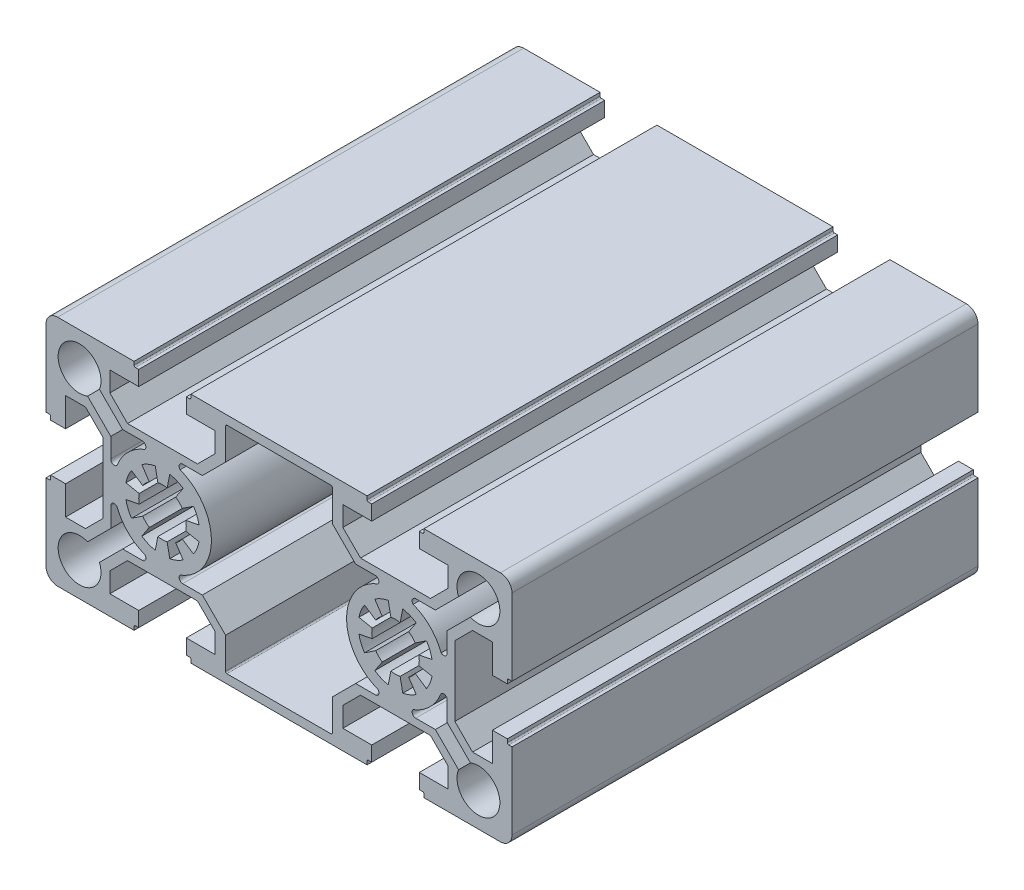
from build123d import *

# Parameters (mm, degrees)
EXTRUDE_1_DEPTH = 100


with BuildPart() as part:
    # 草图1 → 凸台-拉伸1 (new body)
    with BuildSketch(Plane.XY):
        with BuildLine():
            Line((-31.582808051, 26.059817672), (-47.982808051, 26.059817672))
            ThreePointArc((-47.982808051, 26.059817672), (-49.750575003, 25.327584625), (-50.482808051, 23.559817672))
            Line((-50.482808051, 23.559817672), (-50.482808051, 7.159817672))
            Line((-50.482808051, 7.159817672), (-49.782808051, 7.159817672))
            ThreePointArc((-49.782808051, 7.159817672), (-49.570676016, 7.071949706), (-49.482808051, 6.859817672))
            Line((-49.482808051, 6.859817672), (-49.482808051, 6.159817672))
            Line((-49.482808051, 6.159817672), (-46.282808051, 6.159817672))
            Line((-46.282808051, 6.159817672), (-46.282808051, 12.359817672))
            Line((-46.282808051, 12.359817672), (-42.015398231, 12.359817672))
            Line((-42.015398231, 12.359817672), (-38.215398231, 8.559817672))
            Line((-38.215398231, 8.559817672), (-38.215398231, 1.059817672))
            Line((-38.215398231, 1.059817672), (-38.215398231, -6.440182328))
            Line((-38.215398231, -6.440182328), (-42.015398231, -10.240182328))
            Line((-42.015398231, -10.240182328), (-46.282808051, -10.240182328))
            Line((-46.282808051, -10.240182328), (-46.282808051, -4.040182328))
            Line((-46.282808051, -4.040182328), (-49.482808051, -4.040182328))
            Line((-49.482808051, -4.040182328), (-49.482808051, -4.740182328))
            ThreePointArc((-49.482808051, -4.740182328), (-49.570676016, -4.952314363), (-49.782808051, -5.040182328))
            Line((-49.782808051, -5.040182328), (-50.482808051, -5.040182328))
            Line((-50.482808051, -5.040182328), (-50.482808051, -21.440182328))
            ThreePointArc((-50.482808051, -21.440182328), (-49.750575003, -23.207949281), (-47.982808051, -23.940182328))
            Line((-47.982808051, -23.940182328), (-31.582808051, -23.940182328))
            Line((-31.582808051, -23.940182328), (-31.582808051, -23.240182328))
            ThreePointArc((-31.582808051, -23.240182328), (-31.494940085, -23.028050294), (-31.282808051, -22.940182328))
            Line((-31.282808051, -22.940182328), (-30.582808051, -22.940182328))
            Line((-30.582808051, -22.940182328), (-30.582808051, -19.740182328))
            Line((-30.582808051, -19.740182328), (-36.782808051, -19.740182328))
            Line((-36.782808051, -19.740182328), (-36.782808051, -15.472772509))
            Line((-36.782808051, -15.472772509), (-32.982808051, -11.672772509))
            Line((-32.982808051, -11.672772509), (-25.482808051, -11.672772509))
            Line((-25.482808051, -11.672772509), (-17.982808051, -11.672772509))
            Line((-17.982808051, -11.672772509), (-14.182808051, -15.472772509))
            Line((-14.182808051, -15.472772509), (-14.182808051, -19.740182328))
            Line((-14.182808051, -19.740182328), (-20.382808051, -19.740182328))
            Line((-20.382808051, -19.740182328), (-20.382808051, -22.940182328))
            Line((-20.382808051, -22.940182328), (-19.682808051, -22.940182328))
            ThreePointArc((-19.682808051, -22.940182328), (-19.470676016, -23.028050294), (-19.382808051, -23.240182328))
            Line((-19.382808051, -23.240182328), (-19.382808051, -23.940182328))
            Line((-19.382808051, -23.940182328), (-2.982808051, -23.940182328))
            Line((-2.982808051, -23.940182328), (2.017191949, -23.940182328))
            Line((2.017191949, -23.940182328), (18.417191949, -23.940182328))
            Line((18.417191949, -23.940182328), (18.417191949, -23.240182328))
            ThreePointArc((18.417191949, -23.240182328), (18.505059915, -23.028050294), (18.717191949, -22.940182328))
            Line((18.717191949, -22.940182328), (19.417191949, -22.940182328))
            Line((19.417191949, -22.940182328), (19.417191949, -19.740182328))
            Line((19.417191949, -19.740182328), (13.217191949, -19.740182328))
            Line((13.217191949, -19.740182328), (13.217191949, -15.472772509))
            Line((13.217191949, -15.472772509), (17.017191949, -11.672772509))
            Line((17.017191949, -11.672772509), (24.517191949, -11.672772509))
            Line((24.517191949, -11.672772509), (32.017191949, -11.672772509))
            Line((32.017191949, -11.672772509), (35.817191949, -15.472772509))
            Line((35.817191949, -15.472772509), (35.817191949, -19.740182328))
            Line((35.817191949, -19.740182328), (29.617191949, -19.740182328))
            Line((29.617191949, -19.740182328), (29.617191949, -22.940182328))
            Line((29.617191949, -22.940182328), (30.317191949, -22.940182328))
            ThreePointArc((30.317191949, -22.940182328), (30.529323984, -23.028050294), (30.617191949, -23.240182328))
            Line((30.617191949, -23.240182328), (30.617191949, -23.940182328))
            Line((30.617191949, -23.940182328), (47.017191949, -23.940182328))
            ThreePointArc((47.017191949, -23.940182328), (48.784958902, -23.207949281), (49.517191949, -21.440182328))
            Line((49.517191949, -21.440182328), (49.517191949, -5.040182328))
            Line((49.517191949, -5.040182328), (48.817191949, -5.040182328))
            ThreePointArc((48.817191949, -5.040182328), (48.605059915, -4.952314363), (48.517191949, -4.740182328))
            Line((48.517191949, -4.740182328), (48.517191949, -4.040182328))
            Line((48.517191949, -4.040182328), (45.317191949, -4.040182328))
            Line((45.317191949, -4.040182328), (45.317191949, -10.240182328))
            Line((45.317191949, -10.240182328), (41.04978213, -10.240182328))
            Line((41.04978213, -10.240182328), (37.24978213, -6.440182328))
            Line((37.24978213, -6.440182328), (37.24978213, 1.059817672))
            Line((37.24978213, 1.059817672), (37.24978213, 8.559817672))
            Line((37.24978213, 8.559817672), (41.04978213, 12.359817672))
            Line((41.04978213, 12.359817672), (45.317191949, 12.359817672))
            Line((45.317191949, 12.359817672), (45.317191949, 6.159817672))
            Line((45.317191949, 6.159817672), (48.517191949, 6.159817672))
            Line((48.517191949, 6.159817672), (48.517191949, 6.859817672))
            ThreePointArc((48.517191949, 6.859817672), (48.605059915, 7.071949706), (48.817191949, 7.159817672))
            Line((48.817191949, 7.159817672), (49.517191949, 7.159817672))
            Line((49.517191949, 7.159817672), (49.517191949, 23.559817672))
            ThreePointArc((49.517191949, 23.559817672), (48.784958902, 25.327584625), (47.017191949, 26.059817672))
            Line((47.017191949, 26.059817672), (30.617191949, 26.059817672))
            Line((30.617191949, 26.059817672), (30.617191949, 25.359817672))
            ThreePointArc((30.617191949, 25.359817672), (30.529323984, 25.147685637), (30.317191949, 25.059817672))
            Line((30.317191949, 25.059817672), (29.617191949, 25.059817672))
            Line((29.617191949, 25.059817672), (29.617191949, 21.859817672))
            Line((29.617191949, 21.859817672), (35.817191949, 21.859817672))
            Line((35.817191949, 21.859817672), (35.817191949, 17.592407853))
            Line((35.817191949, 17.592407853), (32.017191949, 13.792407853))
            Line((32.017191949, 13.792407853), (24.517191949, 13.792407853))
            Line((24.517191949, 13.792407853), (17.017191949, 13.792407853))
            Line((17.017191949, 13.792407853), (13.217191949, 17.592407853))
            Line((13.217191949, 17.592407853), (13.217191949, 21.859817672))
            Line((13.217191949, 21.859817672), (19.417191949, 21.859817672))
            Line((19.417191949, 21.859817672), (19.417191949, 25.059817672))
            Line((19.417191949, 25.059817672), (18.717191949, 25.059817672))
            ThreePointArc((18.717191949, 25.059817672), (18.505059915, 25.147685637), (18.417191949, 25.359817672))
            Line((18.417191949, 25.359817672), (18.417191949, 26.059817672))
            Line((18.417191949, 26.059817672), (2.017191949, 26.059817672))
            Line((2.017191949, 26.059817672), (-2.982808051, 26.059817672))
            Line((-2.982808051, 26.059817672), (-19.382808051, 26.059817672))
            Line((-19.382808051, 26.059817672), (-19.382808051, 25.359817672))
            ThreePointArc((-19.382808051, 25.359817672), (-19.470676016, 25.147685637), (-19.682808051, 25.059817672))
            Line((-19.682808051, 25.059817672), (-20.382808051, 25.059817672))
            Line((-20.382808051, 25.059817672), (-20.382808051, 21.859817672))
            Line((-20.382808051, 21.859817672), (-14.182808051, 21.859817672))
            Line((-14.182808051, 21.859817672), (-14.182808051, 17.592407853))
            Line((-14.182808051, 17.592407853), (-17.982808051, 13.792407853))
            Line((-17.982808051, 13.792407853), (-25.482808051, 13.792407853))
            Line((-25.482808051, 13.792407853), (-32.982808051, 13.792407853))
            Line((-32.982808051, 13.792407853), (-36.782808051, 17.592407853))
            Line((-36.782808051, 17.592407853), (-36.782808051, 21.859817672))
            Line((-36.782808051, 21.859817672), (-30.582808051, 21.859817672))
            Line((-30.582808051, 21.859817672), (-30.582808051, 25.059817672))
            Line((-30.582808051, 25.059817672), (-31.282808051, 25.059817672))
            ThreePointArc((-31.282808051, 25.059817672), (-31.494940085, 25.147685637), (-31.582808051, 25.359817672))
            Line((-31.582808051, 25.359817672), (-31.582808051, 26.059817672))
        make_face()
        with BuildLine():
            Line((-36.582808051, 5.391903688), (-36.582808051, 9.61423326))
            Line((-36.582808051, 9.61423326), (-41.562274347, 14.593699556))
            ThreePointArc((-41.562274347, 14.593699556), (-46.535499244, 22.112508865), (-39.016689935, 17.139283969))
            Line((-39.016689935, 17.139283969), (-34.037223638, 12.159817672))
            Line((-34.037223638, 12.159817672), (-29.814894067, 12.159817672))
            ThreePointArc((-29.814894067, 12.159817672), (-29.106940294, 11.688982743), (-29.267414051, 10.854038285))
            ThreePointArc((-29.267414051, 10.854038285), (-32.907429253, 8.484438874), (-35.277028664, 4.844423672))
            ThreePointArc((-35.277028664, 4.844423672), (-36.111973121, 4.683949916), (-36.582808051, 5.391903688))
        make_face(mode=Mode.SUBTRACT)
        with BuildLine():
            Line((-29.927369915, -5.591939227), (-28.316216239, -3.180677351))
            ThreePointArc((-28.316216239, -3.180677351), (-29.089052635, -2.546426912), (-29.723303073, -1.773590517))
            Line((-29.723303073, -1.773590517), (-32.134564949, -3.384744192))
            ThreePointArc((-32.134564949, -3.384744192), (-32.873844311, -2.001649787), (-33.329090294, -0.500904904))
            Line((-33.329090294, -0.500904904), (-30.484812981, 0.06485703))
            ThreePointArc((-30.484812981, 0.06485703), (-30.582808051, 1.059817672), (-30.484812981, 2.054778314))
            Line((-30.484812981, 2.054778314), (-33.329090294, 2.620540248))
            ThreePointArc((-33.329090294, 2.620540248), (-32.873844311, 4.121285131), (-32.134564949, 5.504379536))
            Line((-32.134564949, 5.504379536), (-29.723303073, 3.89322586))
            ThreePointArc((-29.723303073, 3.89322586), (-29.089052635, 4.666062256), (-28.316216239, 5.300312695))
            Line((-28.316216239, 5.300312695), (-29.927369915, 7.71157457))
            ThreePointArc((-29.927369915, 7.71157457), (-28.544275509, 8.450853932), (-27.043530627, 8.906099915))
            Line((-27.043530627, 8.906099915), (-26.477768693, 6.061822602))
            ThreePointArc((-26.477768693, 6.061822602), (-25.482808051, 6.159817672), (-24.487847408, 6.061822602))
            Line((-24.487847408, 6.061822602), (-23.922085474, 8.906099915))
            ThreePointArc((-23.922085474, 8.906099915), (-22.421340592, 8.450853932), (-21.038246186, 7.71157457))
            Line((-21.038246186, 7.71157457), (-22.649399862, 5.300312695))
            ThreePointArc((-22.649399862, 5.300312695), (-21.876563466, 4.666062256), (-21.242313028, 3.89322586))
            Line((-21.242313028, 3.89322586), (-18.831051152, 5.504379536))
            ThreePointArc((-18.831051152, 5.504379536), (-18.09177179, 4.121285131), (-17.636525807, 2.620540248))
            Line((-17.636525807, 2.620540248), (-20.48080312, 2.054778314))
            ThreePointArc((-20.48080312, 2.054778314), (-20.382808051, 1.059817672), (-20.48080312, 0.06485703))
            Line((-20.48080312, 0.06485703), (-17.636525807, -0.500904904))
            ThreePointArc((-17.636525807, -0.500904904), (-18.09177179, -2.001649787), (-18.831051152, -3.384744192))
            Line((-18.831051152, -3.384744192), (-21.242313028, -1.773590517))
            ThreePointArc((-21.242313028, -1.773590517), (-21.876563466, -2.546426912), (-22.649399862, -3.180677351))
            Line((-22.649399862, -3.180677351), (-21.038246186, -5.591939227))
            ThreePointArc((-21.038246186, -5.591939227), (-22.421340592, -6.331218588), (-23.922085474, -6.786464571))
            Line((-23.922085474, -6.786464571), (-24.487847408, -3.942187258))
            ThreePointArc((-24.487847408, -3.942187258), (-25.482808051, -4.040182328), (-26.477768693, -3.942187258))
            Line((-26.477768693, -3.942187258), (-27.043530627, -6.786464571))
            ThreePointArc((-27.043530627, -6.786464571), (-28.544275509, -6.331218588), (-29.927369915, -5.591939227))
        make_face(mode=Mode.SUBTRACT)
        with BuildLine():
            Line((-11.948926166, 17.139283969), (-11.948926166, 23.859817672))
            ThreePointArc((-11.948926166, 23.859817672), (-11.8610582, 24.071949706), (-11.648926166, 24.159817672))
            Line((-11.648926166, 24.159817672), (-2.982808051, 24.159817672))
            Line((-2.982808051, 24.159817672), (2.017191949, 24.159817672))
            Line((2.017191949, 24.159817672), (10.683310065, 24.159817672))
            ThreePointArc((10.683310065, 24.159817672), (10.895442099, 24.071949706), (10.983310065, 23.859817672))
            Line((10.983310065, 23.859817672), (10.983310065, 17.139283969))
            Line((10.983310065, 17.139283969), (15.962776362, 12.159817672))
            Line((15.962776362, 12.159817672), (20.185105933, 12.159817672))
            ThreePointArc((20.185105933, 12.159817672), (20.893059706, 11.688982743), (20.732585949, 10.854038285))
            ThreePointArc((20.732585949, 10.854038285), (17.092570747, 8.484438874), (14.722971336, 4.844423672))
            ThreePointArc((14.722971336, 4.844423672), (14.91551157, -3.189621573), (20.732585949, -8.734402941))
            ThreePointArc((20.732585949, -8.734402941), (20.893059706, -9.569347399), (20.185105933, -10.040182328))
            Line((20.185105933, -10.040182328), (15.962776362, -10.040182328))
            Line((15.962776362, -10.040182328), (10.983310065, -15.019648625))
            Line((10.983310065, -15.019648625), (10.983310065, -21.740182328))
            ThreePointArc((10.983310065, -21.740182328), (10.895442099, -21.952314363), (10.683310065, -22.040182328))
            Line((10.683310065, -22.040182328), (2.017191949, -22.040182328))
            Line((2.017191949, -22.040182328), (-2.982808051, -22.040182328))
            Line((-2.982808051, -22.040182328), (-11.648926166, -22.040182328))
            ThreePointArc((-11.648926166, -22.040182328), (-11.8610582, -21.952314363), (-11.948926166, -21.740182328))
            Line((-11.948926166, -21.740182328), (-11.948926166, -15.019648625))
            Line((-11.948926166, -15.019648625), (-16.928392463, -10.040182328))
            Line((-16.928392463, -10.040182328), (-21.150722035, -10.040182328))
            ThreePointArc((-21.150722035, -10.040182328), (-21.858675807, -9.569347399), (-21.69820205, -8.734402941))
            ThreePointArc((-21.69820205, -8.734402941), (-15.881127671, -3.189621573), (-15.688587437, 4.844423672))
            ThreePointArc((-15.688587437, 4.844423672), (-18.058186848, 8.484438874), (-21.69820205, 10.854038285))
            ThreePointArc((-21.69820205, 10.854038285), (-21.858675807, 11.688982743), (-21.150722035, 12.159817672))
            Line((-21.150722035, 12.159817672), (-16.928392463, 12.159817672))
            Line((-16.928392463, 12.159817672), (-11.948926166, 17.139283969))
        make_face(mode=Mode.SUBTRACT)
        with BuildLine():
            Line((-36.582808051, -3.272268344), (-36.582808051, -7.494597916))
            Line((-36.582808051, -7.494597916), (-41.562274347, -12.474064213))
            ThreePointArc((-41.562274347, -12.474064213), (-46.535499244, -19.992873522), (-39.016689935, -15.019648625))
            Line((-39.016689935, -15.019648625), (-34.037223638, -10.040182328))
            Line((-34.037223638, -10.040182328), (-29.814894067, -10.040182328))
            ThreePointArc((-29.814894067, -10.040182328), (-29.106940294, -9.569347399), (-29.267414051, -8.734402941))
            ThreePointArc((-29.267414051, -8.734402941), (-32.907429253, -6.364803531), (-35.277028664, -2.724788329))
            ThreePointArc((-35.277028664, -2.724788329), (-36.111973121, -2.564314572), (-36.582808051, -3.272268344))
        make_face(mode=Mode.SUBTRACT)
        with BuildLine():
            Line((20.072630085, -5.591939227), (21.683783761, -3.180677351))
            ThreePointArc((21.683783761, -3.180677351), (20.910947365, -2.546426912), (20.276696927, -1.773590517))
            Line((20.276696927, -1.773590517), (17.865435051, -3.384744192))
            ThreePointArc((17.865435051, -3.384744192), (17.126155689, -2.001649787), (16.670909706, -0.500904904))
            Line((16.670909706, -0.500904904), (19.515187019, 0.06485703))
            ThreePointArc((19.515187019, 0.06485703), (19.417191949, 1.059817672), (19.515187019, 2.054778314))
            Line((19.515187019, 2.054778314), (16.670909706, 2.620540248))
            ThreePointArc((16.670909706, 2.620540248), (17.126155689, 4.121285131), (17.865435051, 5.504379536))
            Line((17.865435051, 5.504379536), (20.276696927, 3.89322586))
            ThreePointArc((20.276696927, 3.89322586), (20.910947365, 4.666062256), (21.683783761, 5.300312695))
            Line((21.683783761, 5.300312695), (20.072630085, 7.71157457))
            ThreePointArc((20.072630085, 7.71157457), (21.455724491, 8.450853932), (22.956469373, 8.906099915))
            Line((22.956469373, 8.906099915), (23.522231307, 6.061822602))
            ThreePointArc((23.522231307, 6.061822602), (24.517191949, 6.159817672), (25.512152592, 6.061822602))
            Line((25.512152592, 6.061822602), (26.077914526, 8.906099915))
            ThreePointArc((26.077914526, 8.906099915), (27.578659408, 8.450853932), (28.961753814, 7.71157457))
            Line((28.961753814, 7.71157457), (27.350600138, 5.300312695))
            ThreePointArc((27.350600138, 5.300312695), (28.123436534, 4.666062256), (28.757686972, 3.89322586))
            Line((28.757686972, 3.89322586), (31.168948848, 5.504379536))
            ThreePointArc((31.168948848, 5.504379536), (31.90822821, 4.121285131), (32.363474193, 2.620540248))
            Line((32.363474193, 2.620540248), (29.51919688, 2.054778314))
            ThreePointArc((29.51919688, 2.054778314), (29.617191949, 1.059817672), (29.51919688, 0.06485703))
            Line((29.51919688, 0.06485703), (32.363474193, -0.500904904))
            ThreePointArc((32.363474193, -0.500904904), (31.90822821, -2.001649787), (31.168948848, -3.384744192))
            Line((31.168948848, -3.384744192), (28.757686972, -1.773590517))
            ThreePointArc((28.757686972, -1.773590517), (28.123436534, -2.546426912), (27.350600138, -3.180677351))
            Line((27.350600138, -3.180677351), (28.961753814, -5.591939227))
            ThreePointArc((28.961753814, -5.591939227), (27.578659408, -6.331218588), (26.077914526, -6.786464571))
            Line((26.077914526, -6.786464571), (25.512152592, -3.942187258))
            ThreePointArc((25.512152592, -3.942187258), (24.517191949, -4.040182328), (23.522231307, -3.942187258))
            Line((23.522231307, -3.942187258), (22.956469373, -6.786464571))
            ThreePointArc((22.956469373, -6.786464571), (21.455724491, -6.331218588), (20.072630085, -5.591939227))
        make_face(mode=Mode.SUBTRACT)
        with BuildLine():
            Line((35.617191949, 5.391903688), (35.617191949, 9.61423326))
            Line((35.617191949, 9.61423326), (40.596658246, 14.593699556))
            ThreePointArc((40.596658246, 14.593699556), (45.569883143, 22.112508865), (38.051073834, 17.139283969))
            Line((38.051073834, 17.139283969), (33.071607537, 12.159817672))
            Line((33.071607537, 12.159817672), (28.849277965, 12.159817672))
            ThreePointArc((28.849277965, 12.159817672), (28.141324193, 11.688982743), (28.30179795, 10.854038285))
            ThreePointArc((28.30179795, 10.854038285), (31.941813152, 8.484438874), (34.311412563, 4.844423672))
            ThreePointArc((34.311412563, 4.844423672), (35.14635702, 4.683949916), (35.617191949, 5.391903688))
        make_face(mode=Mode.SUBTRACT)
        with BuildLine():
            Line((35.617191949, -3.272268344), (35.617191949, -7.494597916))
            Line((35.617191949, -7.494597916), (40.596658246, -12.474064213))
            ThreePointArc((40.596658246, -12.474064213), (45.569883143, -19.992873522), (38.051073834, -15.019648625))
            Line((38.051073834, -15.019648625), (33.071607537, -10.040182328))
            Line((33.071607537, -10.040182328), (28.849277965, -10.040182328))
            ThreePointArc((28.849277965, -10.040182328), (28.141324193, -9.569347399), (28.30179795, -8.734402941))
            ThreePointArc((28.30179795, -8.734402941), (31.941813152, -6.364803531), (34.311412563, -2.724788329))
            ThreePointArc((34.311412563, -2.724788329), (35.14635702, -2.564314572), (35.617191949, -3.272268344))
        make_face(mode=Mode.SUBTRACT)
    extrude(amount=EXTRUDE_1_DEPTH)


solid = part.part
